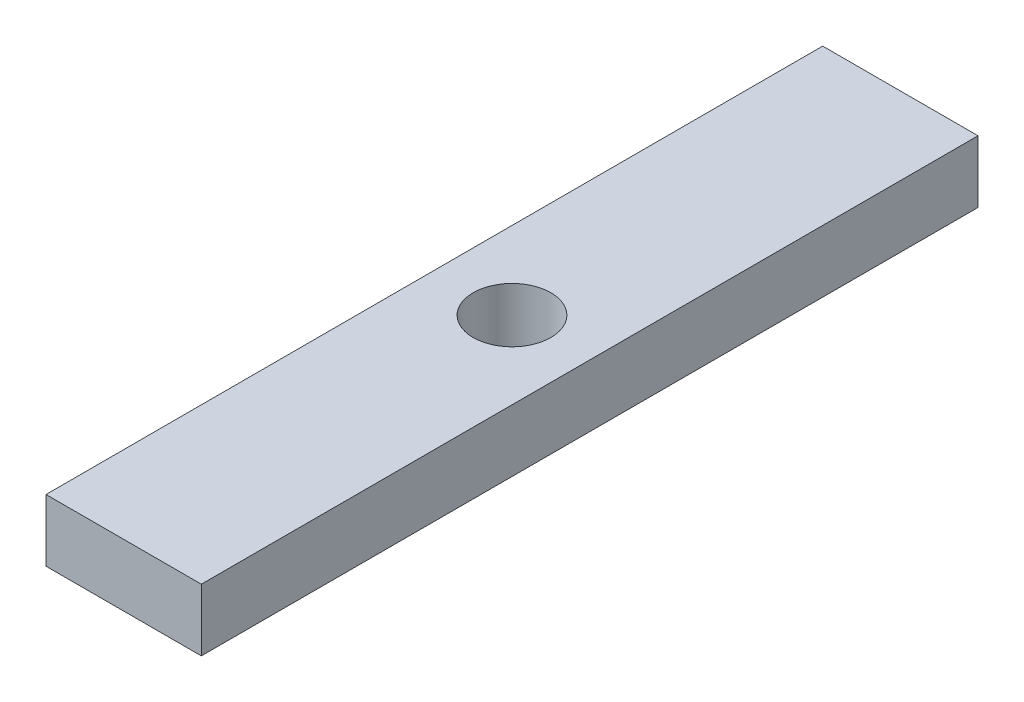
from build123d import *

# Parameters (mm, degrees)
SKETCH_1_W          = 20
SKETCH_1_H          = 100
EXTRUDE_1_DEPTH     = 8
SKETCH_2_R          = 5
CUT_EXTRUDE_1_DEPTH = 10


with BuildPart() as part:
    # 草图1 → 凸台-拉伸1 (new body)
    with BuildSketch(Plane(origin=(0, 0, 0), x_dir=(1, 0, 0), z_dir=(0, 1, 0))):
        with Locations((0, 50)):
            Rectangle(SKETCH_1_W, SKETCH_1_H)
    extrude(amount=EXTRUDE_1_DEPTH)

    # 草图2 → 切除-拉伸1 (cut)
    with BuildSketch(Plane(origin=(0, 8, 0), x_dir=(1, 0, 0), z_dir=(0, 1, 0))):
        with Locations(Location((0, 50, 0), (0, 0, 270))):
            Circle(SKETCH_2_R)
    extrude(amount=-CUT_EXTRUDE_1_DEPTH, mode=Mode.SUBTRACT)


solid = part.part
